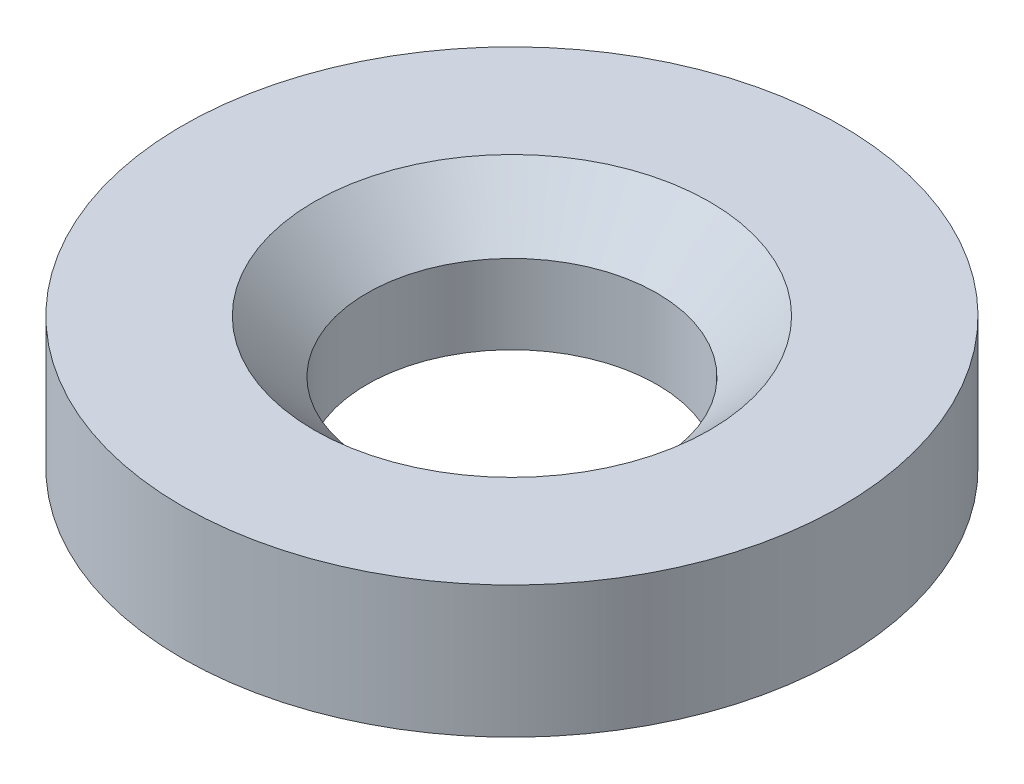
from build123d import *

# Parameters (mm, degrees)
SKETCH1_R           = 2.5
SKETCH1_R_2         = 1.1
BOSS_EXTRUDE1_DEPTH = 1


with BuildPart() as part:
    # Sketch1 → Boss-Extrude1 (new body)
    with BuildSketch(Plane(origin=(0, 0, 0), x_dir=(1, 0, 0), z_dir=(0, 1, 0))):
        with Locations(Location((0, 0, 0), (0, 0, 270))):
            Circle(SKETCH1_R)
        with Locations(Location((0, 0, 0), (0, 0, 270))):
            Circle(SKETCH1_R_2, mode=Mode.SUBTRACT)
    extrude(amount=BOSS_EXTRUDE1_DEPTH)

    # Sketch2 → Cut-Revolve1 (revolve, cut)
    with BuildSketch(Plane.XY, mode=Mode.PRIVATE) as cut_revolve1_sk:
        Polygon((-1.1, 1), (-1.5, 1), (-1.1, 0.6), align=None)
    revolve(cut_revolve1_sk.sketch.rotate(Axis((0, 0, 0), (0, 1, 0)), 270), axis=Axis((0, 0, 0), (0, 1, 0)), mode=Mode.SUBTRACT)


solid = part.part
